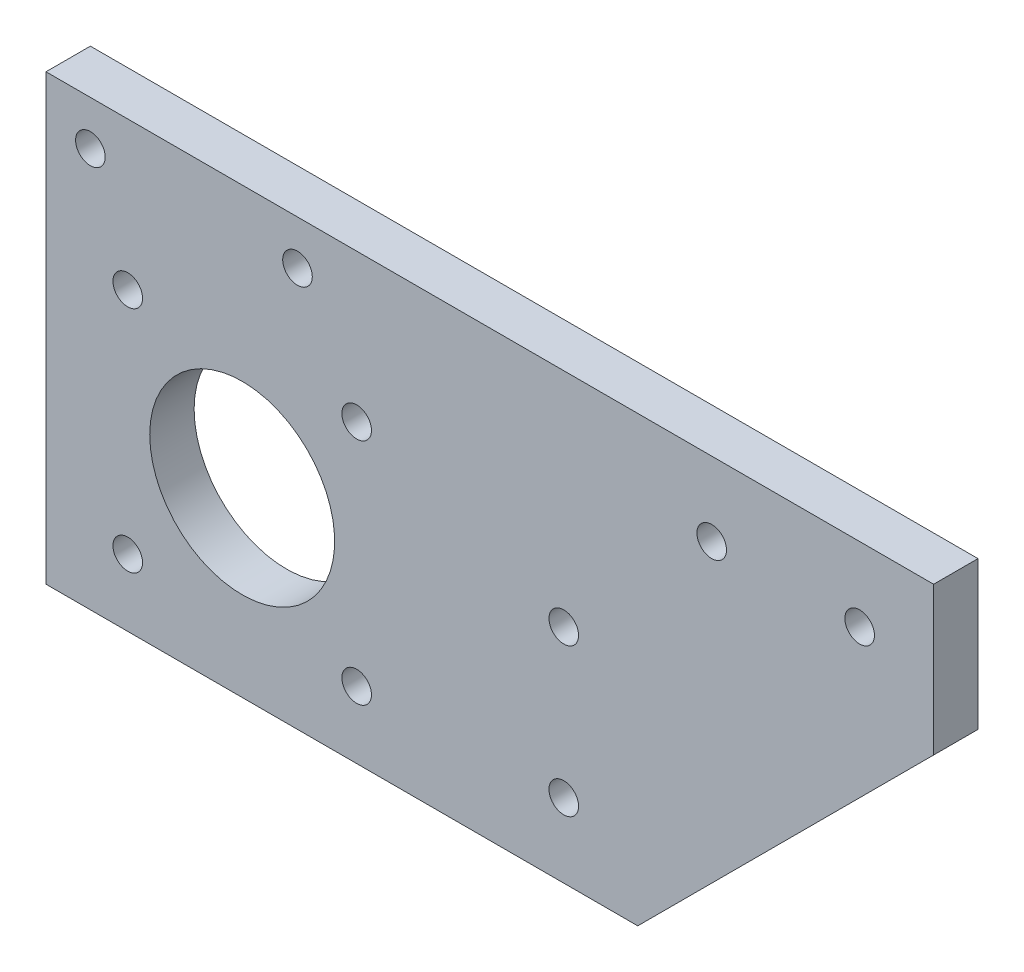
from build123d import *

# Parameters (mm, degrees)
SKETCH1_R           = 2
BOSS_EXTRUDE1_DEPTH = 6
SKETCH2_R           = 2
SKETCH2_R_2         = 12.5
CUT_EXTRUDE1_DEPTH  = 10


with BuildPart() as part:
    # Sketch1 → Boss-Extrude1 (new body)
    with BuildSketch(Plane.XY):
        Polygon((20, -60), (60, -20), (60, 0), (0, 0), (-60, 0), (-60, -60), (0, -60), align=None)
        with Locations((50, -10)):
            Circle(SKETCH1_R, mode=Mode.SUBTRACT)
        with Locations((30, -10)):
            Circle(SKETCH1_R, mode=Mode.SUBTRACT)
        with Locations((10, -50)):
            Circle(SKETCH1_R, mode=Mode.SUBTRACT)
        with Locations((10, -30)):
            Circle(SKETCH1_R, mode=Mode.SUBTRACT)
        with Locations((-54, -6)):
            Circle(SKETCH1_R, mode=Mode.SUBTRACT)
        with Locations((-26, -6)):
            Circle(SKETCH1_R, mode=Mode.SUBTRACT)
    extrude(amount=BOSS_EXTRUDE1_DEPTH)

    # Sketch2 → Cut-Extrude1 (cut)
    with BuildSketch(Plane(origin=(0, 0, 0), x_dir=(-1, 0, 0), z_dir=(0, 0, -1))):
        with Locations((18, -20)):
            Circle(SKETCH2_R)
        with Locations((18, -50.95)):
            Circle(SKETCH2_R)
        with Locations((48.95, -20)):
            Circle(SKETCH2_R)
        with Locations((48.95, -50.95)):
            Circle(SKETCH2_R)
        with Locations((33.475, -35.475)):
            Circle(SKETCH2_R_2)
    extrude(amount=-CUT_EXTRUDE1_DEPTH, mode=Mode.SUBTRACT)


solid = part.part
